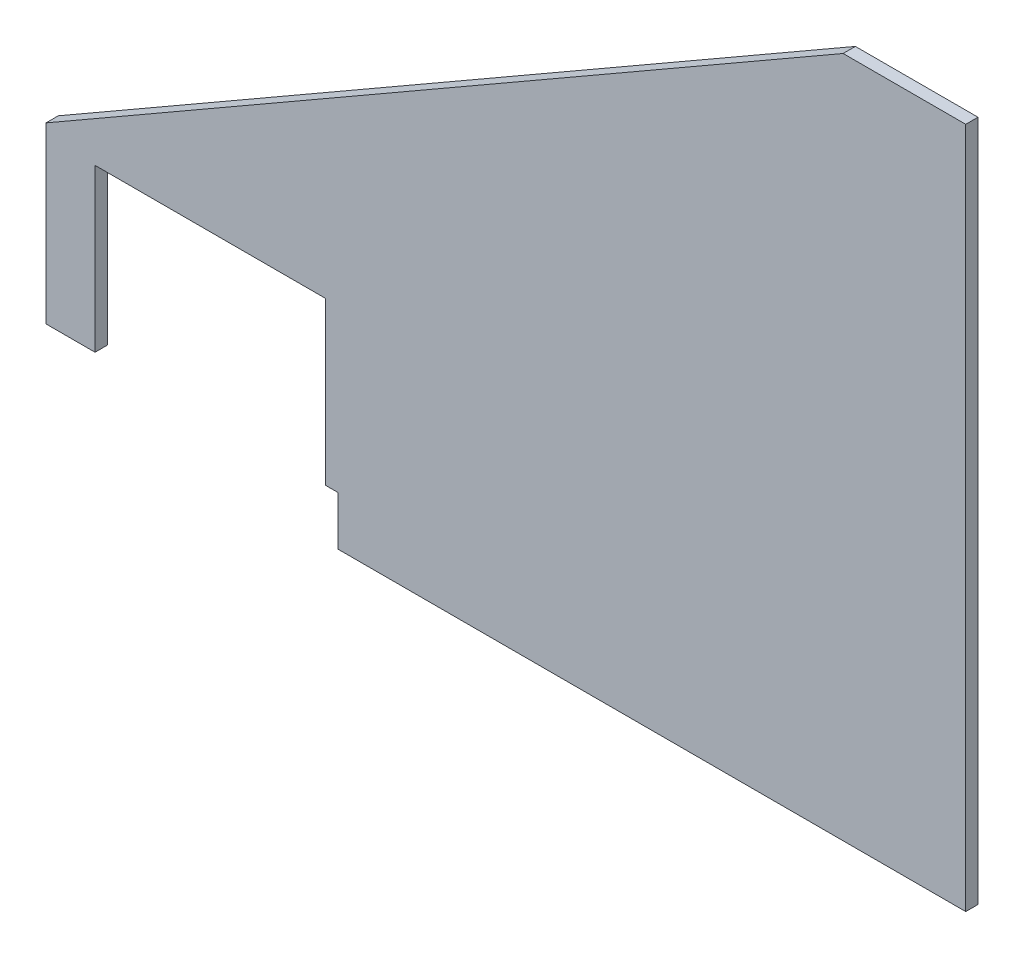
from build123d import *

# Parameters (mm, degrees)
EXTRUDE_1_DEPTH = 5


with BuildPart() as part:
    # 스케치1 → 보스-돌출1 (new body)
    with BuildSketch(Plane.XY):
        Polygon((-128, -139), (128, -139), (128, 139), (78, 139), (-247, -48), (-247, -119), (-227, -119), (-227, -53), (-133, -53), (-133, -119), (-128, -119), align=None)
    extrude(amount=EXTRUDE_1_DEPTH)


solid = part.part
